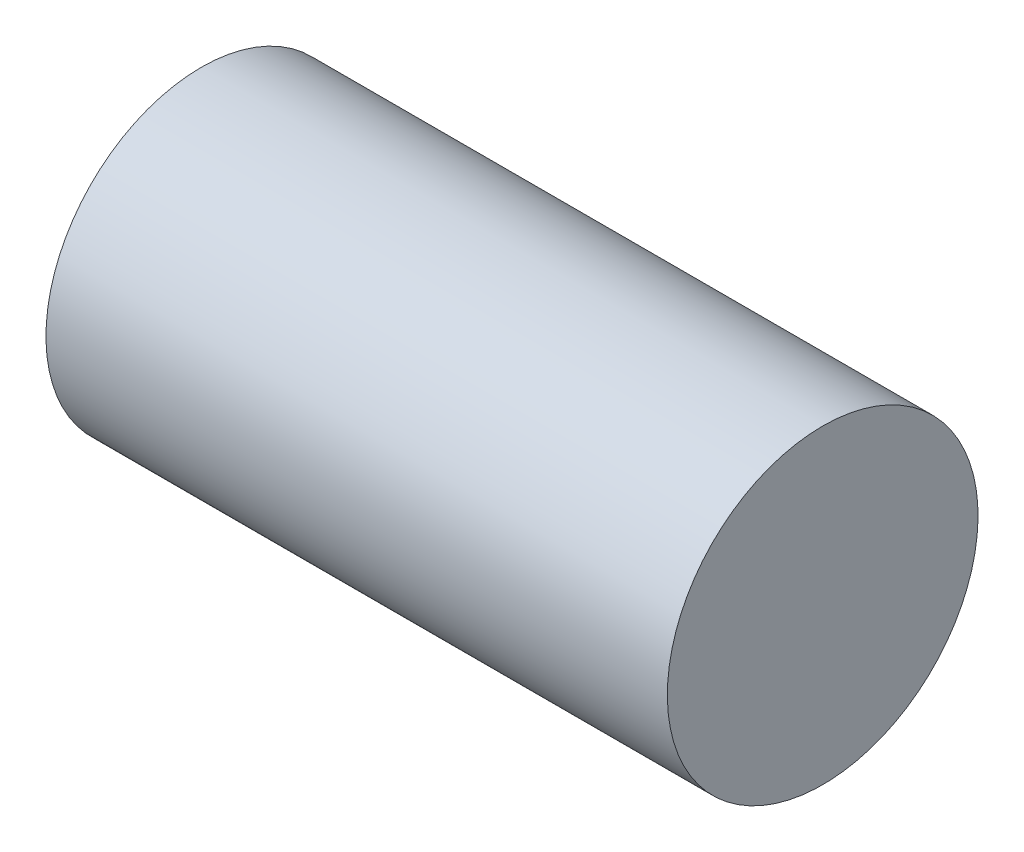
from build123d import *

# Parameters (mm, degrees)
SKETCH1_W = 4
SKETCH1_H = 1


with BuildPart() as part:
    # Sketch1 → Revolve1 (revolve)
    with BuildSketch(Plane.XY):
        with Locations((-2, 0.5)):
            Rectangle(SKETCH1_W, SKETCH1_H)
    revolve(axis=Axis((0, 0, 0), (-1, 0, 0)))


solid = part.part
